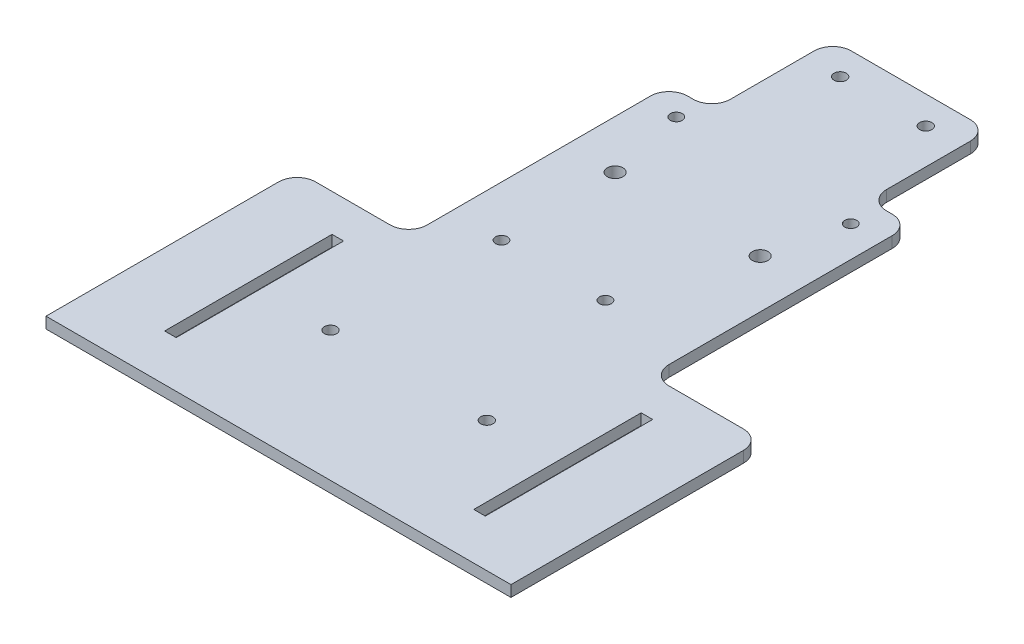
from build123d import *

# Parameters (mm, degrees)
SKETCH1_W           = 3.1
SKETCH1_H           = 45
BOSS_EXTRUDE1_DEPTH = 3
SKETCH3_R           = 1.6
CUT_EXTRUDE2_DEPTH  = 10
CUT_EXTRUDE4_REACH  = 107.547
SKETCH5_R           = 1.65
SKETCH6_R           = 1.65
CUT_EXTRUDE5_DEPTH  = 10
SKETCH8_W           = 30
SKETCH8_H           = 70
CUT_EXTRUDE6_DEPTH  = 10
FILLET1_R           = 5
SKETCH9_R           = 2.1
CUT_EXTRUDE7_DEPTH  = 10


with BuildPart() as part:
    # Sketch1 → Boss-Extrude1 (new body)
    with BuildSketch(Plane(origin=(0, 0, 0), x_dir=(1, 0, 0), z_dir=(0, 1, 0))):
        Polygon((-62.5, -75), (-62.5, -85), (62.5, -85), (62.5, -75), (62.5, -5), (62.5, 85), (-62.5, 85), (-62.5, -5), align=None)
        with Locations((-41.55, -50)):
            Rectangle(SKETCH1_W, SKETCH1_H, mode=Mode.SUBTRACT)
        with Locations((41.55, -50)):
            Rectangle(SKETCH1_W, SKETCH1_H, mode=Mode.SUBTRACT)
    extrude(amount=BOSS_EXTRUDE1_DEPTH)

    # Sketch3 → Cut-Extrude2 (cut)
    with BuildSketch(Plane(origin=(0, 3, 0), x_dir=(1, 0, 0), z_dir=(0, 1, 0))):
        with Locations(Location((-24.15, 46.1, 0), (0, 0, 270))):
            Circle(SKETCH3_R)
        with Locations(Location((24.15, 44.7, 0), (0, 0, 270))):
            Circle(SKETCH3_R)
        with Locations(Location((-18.95, -6.1, 0), (0, 0, 270))):
            Circle(SKETCH3_R)
        with Locations(Location((9, -6.1, 0), (0, 0, 270))):
            Circle(SKETCH3_R)
    extrude(amount=-CUT_EXTRUDE2_DEPTH, mode=Mode.SUBTRACT)

    # Sketch5 → Cut-Extrude4 (cut, up to next)
    with BuildSketch(Plane.XZ, mode=Mode.PRIVATE) as cut_extrude4_sk1:
        with Locations(Location((11.5, -77.5, 0), (0, 0, 270))):
            Circle(SKETCH5_R)
    cut_extrude4_tool1 = extrude(cut_extrude4_sk1.sketch, amount=-CUT_EXTRUDE4_REACH, mode=Mode.PRIVATE) & part.part
    # Sketch5 → Cut-Extrude4 (cut, up to next)
    with BuildSketch(Plane.XZ, mode=Mode.PRIVATE) as cut_extrude4_sk2:
        with Locations(Location((-11.5, -77.5, 0), (0, 0, 270))):
            Circle(SKETCH5_R)
    cut_extrude4_tool2 = extrude(cut_extrude4_sk2.sketch, amount=-CUT_EXTRUDE4_REACH, mode=Mode.PRIVATE) & part.part
    add(cut_extrude4_tool1.solids().sort_by_distance((11.5, 0, -77.5))[0], mode=Mode.SUBTRACT)
    add(cut_extrude4_tool2.solids().sort_by_distance((-11.5, 0, -77.5))[0], mode=Mode.SUBTRACT)

    # Sketch6 → Cut-Extrude5 (cut)
    with BuildSketch(Plane(origin=(0, 3, 0), x_dir=(1, 0, 0), z_dir=(0, 1, 0))):
        with Locations(Location((21, -50, 0), (0, 0, 270))):
            Circle(SKETCH6_R)
        with Locations(Location((-21, -50, 0), (0, 0, 270))):
            Circle(SKETCH6_R)
    extrude(amount=-CUT_EXTRUDE5_DEPTH, mode=Mode.SUBTRACT)

    # Sketch8 → Cut-Extrude6 (cut)
    with BuildSketch(Plane(origin=(0, 3, 0), x_dir=(1, 0, 0), z_dir=(0, 1, 0))):
        with Locations((-47.5, 17.5)):
            Rectangle(SKETCH8_W, SKETCH8_H)
        Polygon((-21, 52.5), (-21, 85), (-62.5, 85), (-62.5, 52.5), (-32.5, 52.5), align=None)
        Polygon((32.5, 52.5), (62.5, 52.5), (62.5, 85), (21, 85), (21, 52.5), align=None)
        with Locations((47.5, 17.5)):
            Rectangle(SKETCH8_W, SKETCH8_H)
    extrude(amount=-CUT_EXTRUDE6_DEPTH, mode=Mode.SUBTRACT)

    # Fillet1
    fillet1_edges = [part.edges().sort_by_distance(p)[0] for p in [
        (21, 1.5, -52.5),
        (21, 1.5, -85),
        (62.5, 1.5, 17.5),
        (32.5, 1.5, 17.5),
        (32.5, 1.5, -52.5),
        (-32.5, 1.5, -52.5),
        (-32.5, 1.5, 17.5),
        (-62.5, 1.5, 17.5),
        (-21, 1.5, -85),
        (-21, 1.5, -52.5),
    ]]
    fillet(fillet1_edges, radius=FILLET1_R)

    # Sketch9 → Cut-Extrude7 (cut)
    with BuildSketch(Plane(origin=(0, 3, 0), x_dir=(1, 0, 0), z_dir=(0, 1, 0))):
        with Locations(Location((19.5, 25, 0), (0, 0, 270))):
            Circle(SKETCH9_R)
        with Locations(Location((-19.5, 25, 0), (0, 0, 270))):
            Circle(SKETCH9_R)
    extrude(amount=-CUT_EXTRUDE7_DEPTH, mode=Mode.SUBTRACT)


solid = part.part
